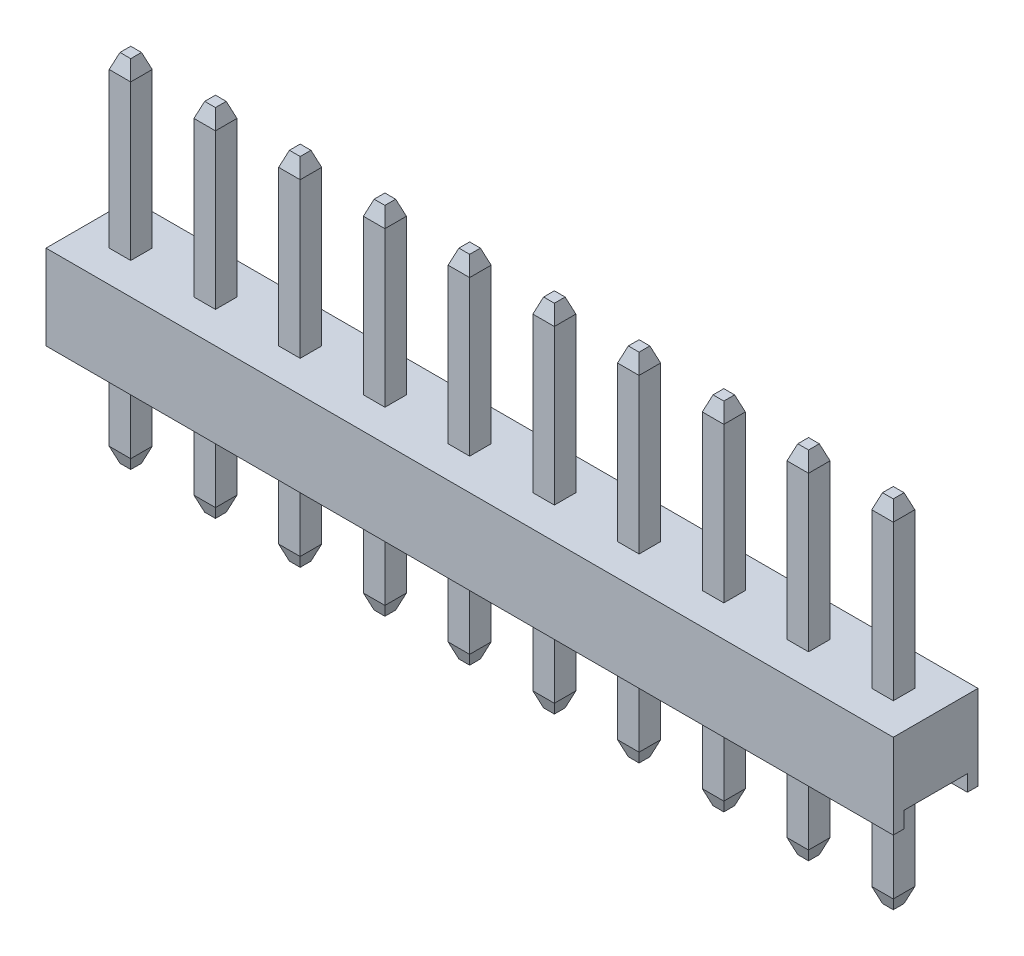
from build123d import *
from OCP.BRepFilletAPI import BRepFilletAPI_MakeChamfer

# Parameters (mm, degrees)
BASE_EXTRUDE_DEPTH                 = 10
PINBODY_START                      = -4.4
SKETCH2_W                          = 0.508
SKETCH2_H                          = 0.508
PINBODY_DEPTH                      = 8.4
PINSCHAMFER_SIZE                   = 0.127
PINSCHAMFER_SIZE2                  = 0.348929632
LPATTERN1_COUNT                    = 5
LPATTERN1_PITCH                    = 2
PINSCHAMFER_OF_LPATTERN1_SIZE      = 0.127
PINSCHAMFER_OF_LPATTERN1_SIZE2     = 0.348929632
LPATTERN1_COL_COUNT                = 6
LPATTERN1_COL_PITCH                = 2.000000064
PINSCHAMFER_OF_LPATTERN1_COL_SIZE  = 0.127
PINSCHAMFER_OF_LPATTERN1_COL_SIZE2 = 0.348929632


with BuildPart() as part:
    # Sketch1 → Base-Extrude (new, symmetric)
    with BuildSketch(Plane(origin=(0, 0, 0), x_dir=(0, 0, -1), z_dir=(1, 0, 0))):
        Polygon((1, 0.409926053), (1, 2), (-1, 2), (-1, 0.409926053), (-1, 0), (-0.75, 0), (-0.75, 0.381), (0.75, 0.381), (0.75, 0), (1, 0), align=None)
    extrude(amount=BASE_EXTRUDE_DEPTH, both=True)

    # Sketch2 → PINBODY (add)
    with BuildSketch(Plane(origin=(0, 2, 0), x_dir=(-1, 0, 0), z_dir=(0, 1, 0)).offset(PINBODY_START)):
        with Locations((1, 0)):
            Rectangle(SKETCH2_W, SKETCH2_H)
    pinbody = extrude(amount=PINBODY_DEPTH)

    # pinsCHAMFER: one chamfer whose edges measure the first distance from different faces: ONE call of the kernel's chamfer builder (chamfer() names one face for all edges)
    pinschamfer_edges_1 = [part.edges().sort_by_distance(p)[0] for p in [
        (-1.254, -2.4, 0),
        (-1, -2.4, 0.254),
        (-0.746, -2.4, 0),
        (-1, -2.4, -0.254),
    ]]
    pinschamfer_side_1 = [part.faces().sort_by_distance(p)[0] for p in [
        (-1, -2.4, 0),
    ]]
    pinschamfer_edges_2 = [part.edges().sort_by_distance(p)[0] for p in [
        (-1.254, 6, 0),
        (-1, 6, 0.254),
        (-0.746, 6, 0),
        (-1, 6, -0.254),
    ]]
    pinschamfer_side_2 = [part.faces().sort_by_distance(p)[0] for p in [
        (-1, 6, 0),
    ]]
    pinschamfer = BRepFilletAPI_MakeChamfer(part.part.solid().wrapped)
    for e in pinschamfer_edges_1:
        pinschamfer.Add(PINSCHAMFER_SIZE, PINSCHAMFER_SIZE2, e.wrapped, pinschamfer_side_1[0].wrapped)  # the first distance lies on this face
    for e in pinschamfer_edges_2:
        pinschamfer.Add(PINSCHAMFER_SIZE, PINSCHAMFER_SIZE2, e.wrapped, pinschamfer_side_2[0].wrapped)  # the first distance lies on this face
    add(Compound.cast(pinschamfer.Shape()), mode=Mode.REPLACE)

    # LPattern1: PINBODY ×5
    with Locations(*[(-i * LPATTERN1_PITCH, 0, 0) for i in range(1, LPATTERN1_COUNT)]):
        add(pinbody)

    # pinsCHAMFER of LPattern1: one chamfer whose edges measure the first distance from different faces: ONE call of the kernel's chamfer builder (chamfer() names one face for all edges)
    pinschamfer_of_lpattern1_edges_1 = [part.edges().sort_by_distance(p)[0] for p in [
        (-3.254, -2.4, 0),
        (-3, -2.4, 0.254),
        (-2.746, -2.4, 0),
        (-3, -2.4, -0.254),
    ]]
    pinschamfer_of_lpattern1_side_1 = [part.faces().sort_by_distance(p)[0] for p in [
        (-3, -2.4, 0),
    ]]
    pinschamfer_of_lpattern1_edges_2 = [part.edges().sort_by_distance(p)[0] for p in [
        (-3.254, 6, 0),
        (-3, 6, 0.254),
        (-2.746, 6, 0),
        (-3, 6, -0.254),
    ]]
    pinschamfer_of_lpattern1_side_2 = [part.faces().sort_by_distance(p)[0] for p in [
        (-3, 6, 0),
    ]]
    pinschamfer_of_lpattern1_edges_3 = [part.edges().sort_by_distance(p)[0] for p in [
        (-5.254, -2.4, 0),
        (-5, -2.4, 0.254),
        (-4.746, -2.4, 0),
        (-5, -2.4, -0.254),
    ]]
    pinschamfer_of_lpattern1_side_3 = [part.faces().sort_by_distance(p)[0] for p in [
        (-5, -2.4, 0),
    ]]
    pinschamfer_of_lpattern1_edges_4 = [part.edges().sort_by_distance(p)[0] for p in [
        (-5.254, 6, 0),
        (-5, 6, 0.254),
        (-4.746, 6, 0),
        (-5, 6, -0.254),
    ]]
    pinschamfer_of_lpattern1_side_4 = [part.faces().sort_by_distance(p)[0] for p in [
        (-5, 6, 0),
    ]]
    pinschamfer_of_lpattern1_edges_5 = [part.edges().sort_by_distance(p)[0] for p in [
        (-7.254, -2.4, 0),
        (-7, -2.4, 0.254),
        (-6.746, -2.4, 0),
        (-7, -2.4, -0.254),
    ]]
    pinschamfer_of_lpattern1_side_5 = [part.faces().sort_by_distance(p)[0] for p in [
        (-7, -2.4, 0),
    ]]
    pinschamfer_of_lpattern1_edges_6 = [part.edges().sort_by_distance(p)[0] for p in [
        (-7.254, 6, 0),
        (-7, 6, 0.254),
        (-6.746, 6, 0),
        (-7, 6, -0.254),
    ]]
    pinschamfer_of_lpattern1_side_6 = [part.faces().sort_by_distance(p)[0] for p in [
        (-7, 6, 0),
    ]]
    pinschamfer_of_lpattern1_edges_7 = [part.edges().sort_by_distance(p)[0] for p in [
        (-9.254, -2.4, 0),
        (-9, -2.4, 0.254),
        (-8.746, -2.4, 0),
        (-9, -2.4, -0.254),
    ]]
    pinschamfer_of_lpattern1_side_7 = [part.faces().sort_by_distance(p)[0] for p in [
        (-9, -2.4, 0),
    ]]
    pinschamfer_of_lpattern1_edges_8 = [part.edges().sort_by_distance(p)[0] for p in [
        (-9.254, 6, 0),
        (-9, 6, 0.254),
        (-8.746, 6, 0),
        (-9, 6, -0.254),
    ]]
    pinschamfer_of_lpattern1_side_8 = [part.faces().sort_by_distance(p)[0] for p in [
        (-9, 6, 0),
    ]]
    pinschamfer_of_lpattern1 = BRepFilletAPI_MakeChamfer(part.part.solid().wrapped)
    for e in pinschamfer_of_lpattern1_edges_1:
        pinschamfer_of_lpattern1.Add(PINSCHAMFER_OF_LPATTERN1_SIZE, PINSCHAMFER_OF_LPATTERN1_SIZE2, e.wrapped, pinschamfer_of_lpattern1_side_1[0].wrapped)  # the first distance lies on this face
    for e in pinschamfer_of_lpattern1_edges_2:
        pinschamfer_of_lpattern1.Add(PINSCHAMFER_OF_LPATTERN1_SIZE, PINSCHAMFER_OF_LPATTERN1_SIZE2, e.wrapped, pinschamfer_of_lpattern1_side_2[0].wrapped)  # the first distance lies on this face
    for e in pinschamfer_of_lpattern1_edges_3:
        pinschamfer_of_lpattern1.Add(PINSCHAMFER_OF_LPATTERN1_SIZE, PINSCHAMFER_OF_LPATTERN1_SIZE2, e.wrapped, pinschamfer_of_lpattern1_side_3[0].wrapped)  # the first distance lies on this face
    for e in pinschamfer_of_lpattern1_edges_4:
        pinschamfer_of_lpattern1.Add(PINSCHAMFER_OF_LPATTERN1_SIZE, PINSCHAMFER_OF_LPATTERN1_SIZE2, e.wrapped, pinschamfer_of_lpattern1_side_4[0].wrapped)  # the first distance lies on this face
    for e in pinschamfer_of_lpattern1_edges_5:
        pinschamfer_of_lpattern1.Add(PINSCHAMFER_OF_LPATTERN1_SIZE, PINSCHAMFER_OF_LPATTERN1_SIZE2, e.wrapped, pinschamfer_of_lpattern1_side_5[0].wrapped)  # the first distance lies on this face
    for e in pinschamfer_of_lpattern1_edges_6:
        pinschamfer_of_lpattern1.Add(PINSCHAMFER_OF_LPATTERN1_SIZE, PINSCHAMFER_OF_LPATTERN1_SIZE2, e.wrapped, pinschamfer_of_lpattern1_side_6[0].wrapped)  # the first distance lies on this face
    for e in pinschamfer_of_lpattern1_edges_7:
        pinschamfer_of_lpattern1.Add(PINSCHAMFER_OF_LPATTERN1_SIZE, PINSCHAMFER_OF_LPATTERN1_SIZE2, e.wrapped, pinschamfer_of_lpattern1_side_7[0].wrapped)  # the first distance lies on this face
    for e in pinschamfer_of_lpattern1_edges_8:
        pinschamfer_of_lpattern1.Add(PINSCHAMFER_OF_LPATTERN1_SIZE, PINSCHAMFER_OF_LPATTERN1_SIZE2, e.wrapped, pinschamfer_of_lpattern1_side_8[0].wrapped)  # the first distance lies on this face
    add(Compound.cast(pinschamfer_of_lpattern1.Shape()), mode=Mode.REPLACE)

    # LPattern1 col: PINBODY ×6
    with Locations(*[(i * LPATTERN1_COL_PITCH, 0, 0) for i in range(1, LPATTERN1_COL_COUNT)]):
        add(pinbody)

    # pinsCHAMFER of LPattern1 col: one chamfer whose edges measure the first distance from different faces: ONE call of the kernel's chamfer builder (chamfer() names one face for all edges)
    pinschamfer_of_lpattern1_col_edges_1 = [part.edges().sort_by_distance(p)[0] for p in [
        (0.746000064, -2.4, 0),
        (1.000000064, -2.4, 0.254),
        (1.254000064, -2.4, 0),
        (1.000000064, -2.4, -0.254),
    ]]
    pinschamfer_of_lpattern1_col_side_1 = [part.faces().sort_by_distance(p)[0] for p in [
        (1.000000064, -2.4, 0),
    ]]
    pinschamfer_of_lpattern1_col_edges_2 = [part.edges().sort_by_distance(p)[0] for p in [
        (0.746000064, 6, 0),
        (1.000000064, 6, 0.254),
        (1.254000064, 6, 0),
        (1.000000064, 6, -0.254),
    ]]
    pinschamfer_of_lpattern1_col_side_2 = [part.faces().sort_by_distance(p)[0] for p in [
        (1.000000064, 6, 0),
    ]]
    pinschamfer_of_lpattern1_col_edges_3 = [part.edges().sort_by_distance(p)[0] for p in [
        (2.746000128, -2.4, 0),
        (3.000000128, -2.4, 0.254),
        (3.254000128, -2.4, 0),
        (3.000000128, -2.4, -0.254),
    ]]
    pinschamfer_of_lpattern1_col_side_3 = [part.faces().sort_by_distance(p)[0] for p in [
        (3.000000128, -2.4, 0),
    ]]
    pinschamfer_of_lpattern1_col_edges_4 = [part.edges().sort_by_distance(p)[0] for p in [
        (2.746000128, 6, 0),
        (3.000000128, 6, 0.254),
        (3.254000128, 6, 0),
        (3.000000128, 6, -0.254),
    ]]
    pinschamfer_of_lpattern1_col_side_4 = [part.faces().sort_by_distance(p)[0] for p in [
        (3.000000128, 6, 0),
    ]]
    pinschamfer_of_lpattern1_col_edges_5 = [part.edges().sort_by_distance(p)[0] for p in [
        (4.746000192, -2.4, 0),
        (5.000000192, -2.4, 0.254),
        (5.254000192, -2.4, 0),
        (5.000000192, -2.4, -0.254),
    ]]
    pinschamfer_of_lpattern1_col_side_5 = [part.faces().sort_by_distance(p)[0] for p in [
        (5.000000192, -2.4, 0),
    ]]
    pinschamfer_of_lpattern1_col_edges_6 = [part.edges().sort_by_distance(p)[0] for p in [
        (4.746000192, 6, 0),
        (5.000000192, 6, 0.254),
        (5.254000192, 6, 0),
        (5.000000192, 6, -0.254),
    ]]
    pinschamfer_of_lpattern1_col_side_6 = [part.faces().sort_by_distance(p)[0] for p in [
        (5.000000192, 6, 0),
    ]]
    pinschamfer_of_lpattern1_col_edges_7 = [part.edges().sort_by_distance(p)[0] for p in [
        (6.746000256, -2.4, 0),
        (7.000000256, -2.4, 0.254),
        (7.254000256, -2.4, 0),
        (7.000000256, -2.4, -0.254),
    ]]
    pinschamfer_of_lpattern1_col_side_7 = [part.faces().sort_by_distance(p)[0] for p in [
        (7.000000256, -2.4, 0),
    ]]
    pinschamfer_of_lpattern1_col_edges_8 = [part.edges().sort_by_distance(p)[0] for p in [
        (6.746000256, 6, 0),
        (7.000000256, 6, 0.254),
        (7.254000256, 6, 0),
        (7.000000256, 6, -0.254),
    ]]
    pinschamfer_of_lpattern1_col_side_8 = [part.faces().sort_by_distance(p)[0] for p in [
        (7.000000256, 6, 0),
    ]]
    pinschamfer_of_lpattern1_col_edges_9 = [part.edges().sort_by_distance(p)[0] for p in [
        (8.74600032, -2.4, 0),
        (9.00000032, -2.4, 0.254),
        (9.25400032, -2.4, 0),
        (9.00000032, -2.4, -0.254),
    ]]
    pinschamfer_of_lpattern1_col_side_9 = [part.faces().sort_by_distance(p)[0] for p in [
        (9.00000032, -2.4, 0),
    ]]
    pinschamfer_of_lpattern1_col_edges_10 = [part.edges().sort_by_distance(p)[0] for p in [
        (8.74600032, 6, 0),
        (9.00000032, 6, 0.254),
        (9.25400032, 6, 0),
        (9.00000032, 6, -0.254),
    ]]
    pinschamfer_of_lpattern1_col_side_10 = [part.faces().sort_by_distance(p)[0] for p in [
        (9.00000032, 6, 0),
    ]]
    pinschamfer_of_lpattern1_col = BRepFilletAPI_MakeChamfer(part.part.solid().wrapped)
    for e in pinschamfer_of_lpattern1_col_edges_1:
        pinschamfer_of_lpattern1_col.Add(PINSCHAMFER_OF_LPATTERN1_COL_SIZE, PINSCHAMFER_OF_LPATTERN1_COL_SIZE2, e.wrapped, pinschamfer_of_lpattern1_col_side_1[0].wrapped)  # the first distance lies on this face
    for e in pinschamfer_of_lpattern1_col_edges_2:
        pinschamfer_of_lpattern1_col.Add(PINSCHAMFER_OF_LPATTERN1_COL_SIZE, PINSCHAMFER_OF_LPATTERN1_COL_SIZE2, e.wrapped, pinschamfer_of_lpattern1_col_side_2[0].wrapped)  # the first distance lies on this face
    for e in pinschamfer_of_lpattern1_col_edges_3:
        pinschamfer_of_lpattern1_col.Add(PINSCHAMFER_OF_LPATTERN1_COL_SIZE, PINSCHAMFER_OF_LPATTERN1_COL_SIZE2, e.wrapped, pinschamfer_of_lpattern1_col_side_3[0].wrapped)  # the first distance lies on this face
    for e in pinschamfer_of_lpattern1_col_edges_4:
        pinschamfer_of_lpattern1_col.Add(PINSCHAMFER_OF_LPATTERN1_COL_SIZE, PINSCHAMFER_OF_LPATTERN1_COL_SIZE2, e.wrapped, pinschamfer_of_lpattern1_col_side_4[0].wrapped)  # the first distance lies on this face
    for e in pinschamfer_of_lpattern1_col_edges_5:
        pinschamfer_of_lpattern1_col.Add(PINSCHAMFER_OF_LPATTERN1_COL_SIZE, PINSCHAMFER_OF_LPATTERN1_COL_SIZE2, e.wrapped, pinschamfer_of_lpattern1_col_side_5[0].wrapped)  # the first distance lies on this face
    for e in pinschamfer_of_lpattern1_col_edges_6:
        pinschamfer_of_lpattern1_col.Add(PINSCHAMFER_OF_LPATTERN1_COL_SIZE, PINSCHAMFER_OF_LPATTERN1_COL_SIZE2, e.wrapped, pinschamfer_of_lpattern1_col_side_6[0].wrapped)  # the first distance lies on this face
    for e in pinschamfer_of_lpattern1_col_edges_7:
        pinschamfer_of_lpattern1_col.Add(PINSCHAMFER_OF_LPATTERN1_COL_SIZE, PINSCHAMFER_OF_LPATTERN1_COL_SIZE2, e.wrapped, pinschamfer_of_lpattern1_col_side_7[0].wrapped)  # the first distance lies on this face
    for e in pinschamfer_of_lpattern1_col_edges_8:
        pinschamfer_of_lpattern1_col.Add(PINSCHAMFER_OF_LPATTERN1_COL_SIZE, PINSCHAMFER_OF_LPATTERN1_COL_SIZE2, e.wrapped, pinschamfer_of_lpattern1_col_side_8[0].wrapped)  # the first distance lies on this face
    for e in pinschamfer_of_lpattern1_col_edges_9:
        pinschamfer_of_lpattern1_col.Add(PINSCHAMFER_OF_LPATTERN1_COL_SIZE, PINSCHAMFER_OF_LPATTERN1_COL_SIZE2, e.wrapped, pinschamfer_of_lpattern1_col_side_9[0].wrapped)  # the first distance lies on this face
    for e in pinschamfer_of_lpattern1_col_edges_10:
        pinschamfer_of_lpattern1_col.Add(PINSCHAMFER_OF_LPATTERN1_COL_SIZE, PINSCHAMFER_OF_LPATTERN1_COL_SIZE2, e.wrapped, pinschamfer_of_lpattern1_col_side_10[0].wrapped)  # the first distance lies on this face
    add(Compound.cast(pinschamfer_of_lpattern1_col.Shape()), mode=Mode.REPLACE)


solid = part.part
